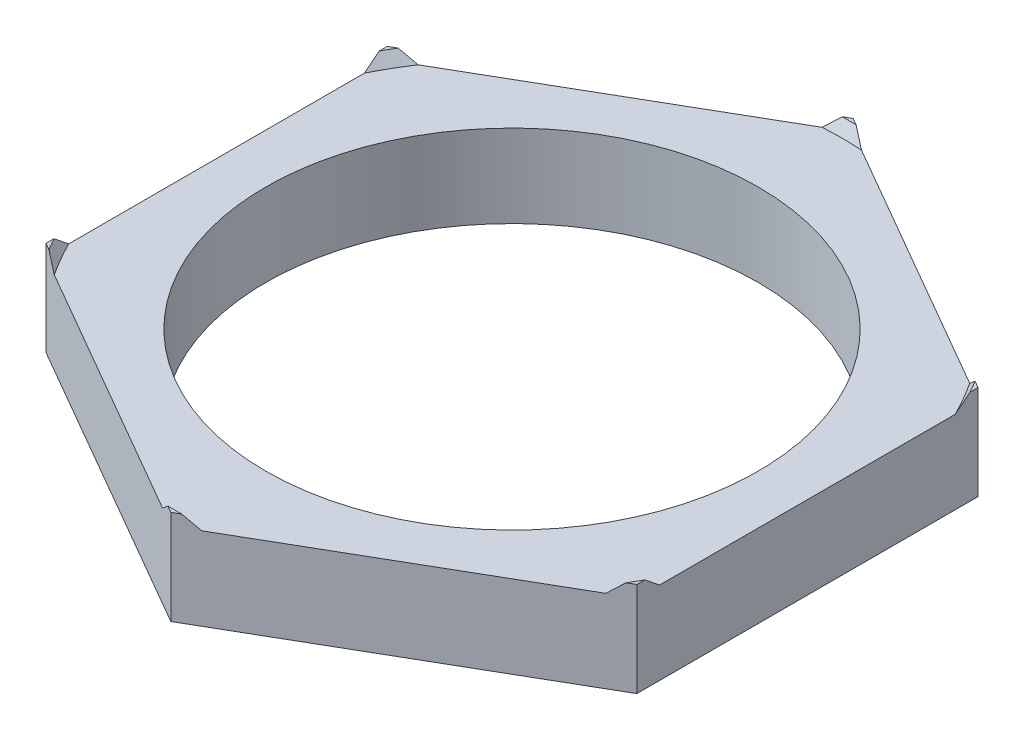
from build123d import *

# Parameters (mm, degrees)
SKETCH1_R      = 12.5
EXTRUDE1_DEPTH = 7


with BuildPart() as part:
    # Sketch1 → Extrude1 (new body)
    with BuildSketch(Plane(origin=(0, 0, 0), x_dir=(1, 0, 0), z_dir=(0, 1, 0))):
        Polygon((0, 17.320508076), (-15, 8.660254038), (-15, -8.660254038), (0, -17.320508076), (15, -8.660254038), (15, 8.660254038), align=None)
        with Locations(Location((0, 0, 0), (0, 0, 270))):
            Circle(SKETCH1_R, mode=Mode.SUBTRACT)
    extrude(amount=EXTRUDE1_DEPTH)

    # Sketch2 → Cut-Revolve1 (revolve, cut)
    with BuildSketch(Plane(origin=(0, 0, 0), x_dir=(0, 0, -1), z_dir=(1, 0, 0)), mode=Mode.PRIVATE) as cut_revolve1_sk:
        Polygon((0, 4.2), (-16.774097914, 4.2), (-17.120508076, 4.8), (-17.320508076, 4.8), (-17.320508076, 15.108314228), (0, 15.108314228), align=None)
    revolve(cut_revolve1_sk.sketch.rotate(Axis((0, 15.108314228, 0), (0, -1, 0)), 180), axis=Axis((0, 15.108314228, 0), (0, -1, 0)), mode=Mode.SUBTRACT)


solid = part.part
